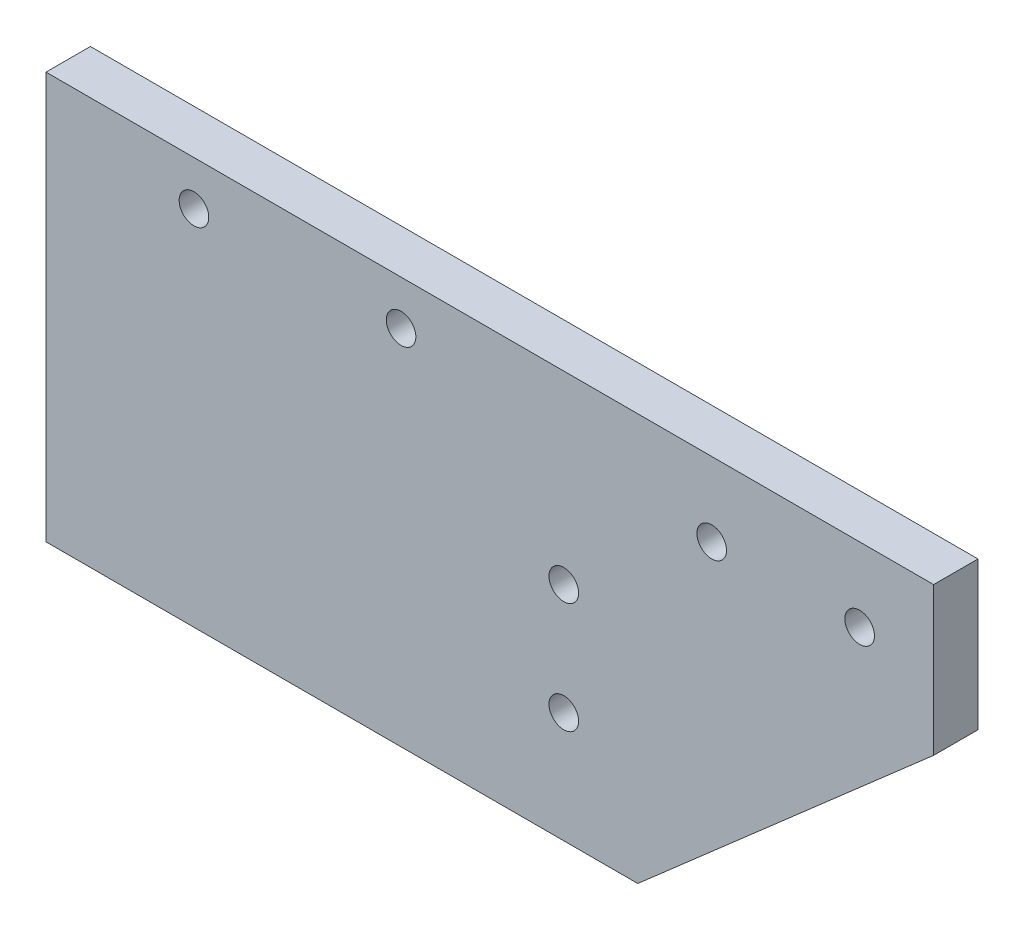
from build123d import *

# Parameters (mm, degrees)
SKETCH1_R           = 2
BOSS_EXTRUDE1_DEPTH = 6


with BuildPart() as part:
    # Sketch1 → Boss-Extrude1 (new body)
    with BuildSketch(Plane.XY):
        Polygon((20, -55), (60, -20), (60, 0), (0, 0), (-60, 0), (-60, -55), (0, -55), align=None)
        with Locations((50, -10)):
            Circle(SKETCH1_R, mode=Mode.SUBTRACT)
        with Locations((30, -10)):
            Circle(SKETCH1_R, mode=Mode.SUBTRACT)
        with Locations((10, -40)):
            Circle(SKETCH1_R, mode=Mode.SUBTRACT)
        with Locations((10, -25)):
            Circle(SKETCH1_R, mode=Mode.SUBTRACT)
        with Locations((-40, -6)):
            Circle(SKETCH1_R, mode=Mode.SUBTRACT)
        with Locations((-12, -6)):
            Circle(SKETCH1_R, mode=Mode.SUBTRACT)
    extrude(amount=BOSS_EXTRUDE1_DEPTH)


solid = part.part
